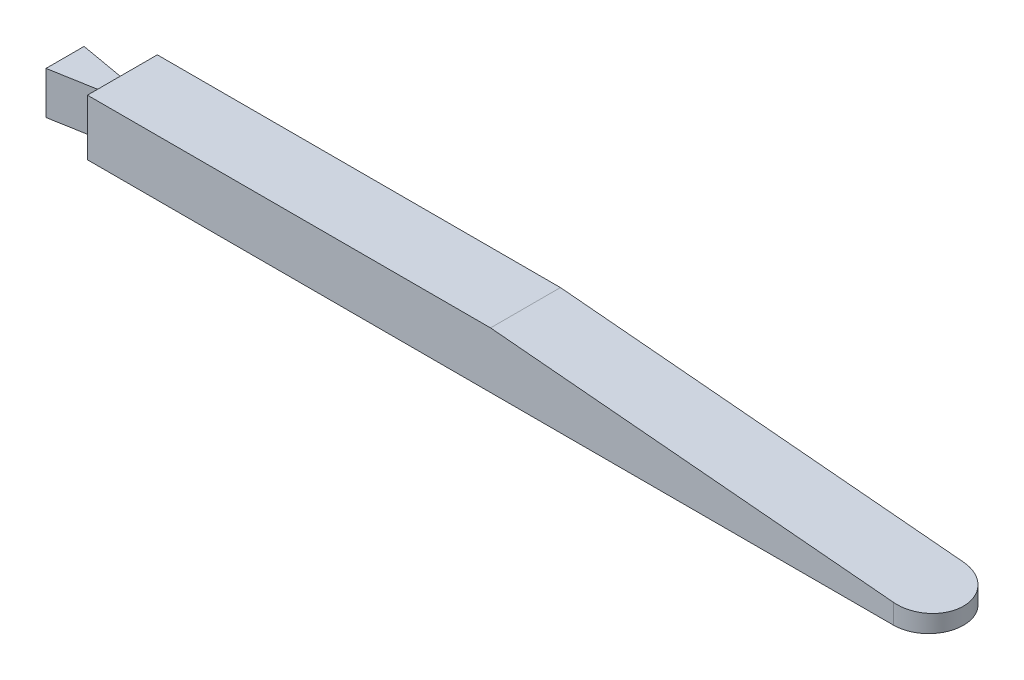
from build123d import *

# Parameters (mm, degrees)
BOSS_EXTRUDE1_DEPTH = 31.75
CUT_EXTRUDE1_DEPTH  = 7.62
CUT_EXTRUDE4_DEPTH  = 39.624


with BuildPart() as part:
    # Sketch2 → Boss-Extrude1 (new body)
    with BuildSketch(Plane(origin=(0, 0, 0), x_dir=(1, 0, 0), z_dir=(0, 1, 0))):
        with BuildLine():
            Line((-18.211768799, -9.91489), (-18.211768799, -31.50489))
            Line((-18.211768799, -31.50489), (14.300231201, -25.772147203))
            Line((14.300231201, -25.772147203), (14.300231201, -40.52189))
            Line((14.300231201, -40.52189), (471.500231201, -40.52189))
            ThreePointArc((471.500231201, -40.52189), (491.312231201, -20.70989), (471.500231201, -0.89789))
            Line((471.500231201, -0.89789), (14.300231201, -0.89789))
            Line((14.300231201, -0.89789), (14.300231201, -15.647632797))
            Line((14.300231201, -15.647632797), (-18.211768799, -9.91489))
        make_face()
    extrude(amount=BOSS_EXTRUDE1_DEPTH)

    # Sketch3 → Cut-Extrude1 (cut)
    with BuildSketch(Plane(origin=(0, 31.75, 0), x_dir=(1, 0, 0), z_dir=(0, 1, 0))):
        Polygon((-18.211768799, -9.91489), (-18.211768799, -31.50489), (14.300231201, -25.772147203), (14.300231201, -15.647632797), align=None)
    extrude(amount=-CUT_EXTRUDE1_DEPTH, mode=Mode.SUBTRACT)

    # Sketch5 → Cut-Extrude4 (cut)
    with BuildSketch(Plane.XY.offset(40.52189)):
        Polygon((242.900231201, 31.75), (491.312231201, 9.425221318), (491.312231201, 31.75), align=None)
    extrude(amount=-CUT_EXTRUDE4_DEPTH, mode=Mode.SUBTRACT)


solid = part.part
